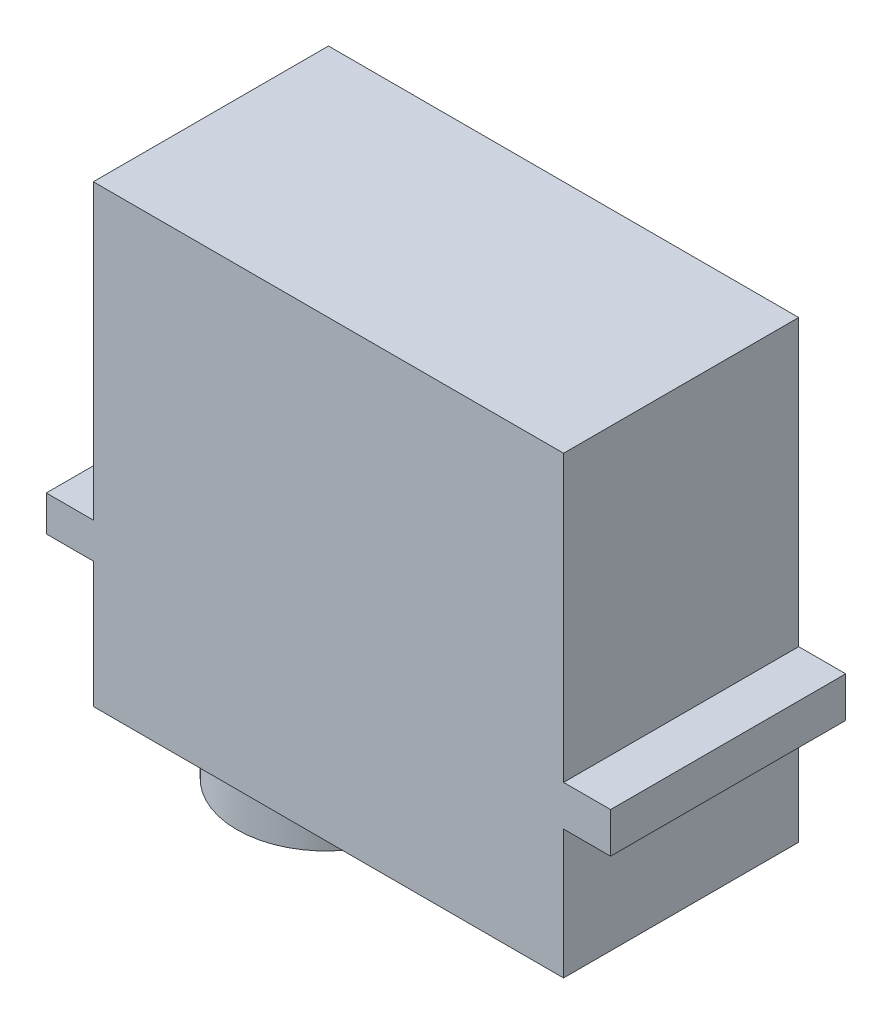
from build123d import *

# Parameters (mm, degrees)
SKETCH_3_W      = 40
SKETCH_3_H      = 38.656537643
EXTRUDE_1_DEPTH = 20
SKETCH_4_R      = 7.571632933
EXTRUDE_2_DEPTH = 6
SKETCH_5_W      = 20
SKETCH_5_H      = 3.020345361
EXTRUDE_3_DEPTH = 4.002234026
SKETCH_6_W      = 20
SKETCH_6_H      = 3.435678125
EXTRUDE_4_DEPTH = 4


with BuildPart() as part:
    # 草图3 → 凸台-拉伸1 (new body)
    with BuildSketch(Plane.XY):
        with Locations((20, 19.328268822)):
            Rectangle(SKETCH_3_W, SKETCH_3_H)
    extrude(amount=EXTRUDE_1_DEPTH)

    # 草图4 → 凸台-拉伸2 (add)
    with BuildSketch(Plane(origin=(0, 0, 0), x_dir=(1, 0, 0), z_dir=(0, 1, 0))):
        with Locations(Location((9.184956981, -9.400712822, 0), (0, 0, 270))):
            Circle(SKETCH_4_R)
    extrude(amount=-EXTRUDE_2_DEPTH)

    # 草图5 → 凸台-拉伸3 (add)
    with BuildSketch(Plane.ZY):
        with Locations((10, 12.220599132)):
            Rectangle(SKETCH_5_W, SKETCH_5_H)
    extrude(amount=EXTRUDE_3_DEPTH)

    # 草图6 → 凸台-拉伸4 (add)
    with BuildSketch(Plane(origin=(40, 0, 0), x_dir=(0, 0, -1), z_dir=(1, 0, 0))):
        with Locations((-10, 12.69140217)):
            Rectangle(SKETCH_6_W, SKETCH_6_H)
    extrude(amount=EXTRUDE_4_DEPTH)


solid = part.part
